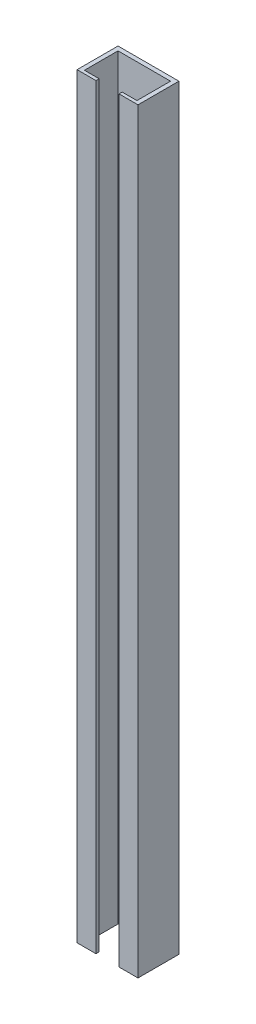
from build123d import *

# Parameters (mm, degrees)
BOSS_EXTRUDE1_DEPTH = 2286


with BuildPart() as part:
    # Sketch1 → Boss-Extrude1 (new, symmetric)
    with BuildSketch(Plane(origin=(0, 0, 0), x_dir=(1, 0, 0), z_dir=(0, 1, 0))):
        Polygon((-184.15, 228.6), (184.15, 228.6), (184.15, -19.05), (69.85, -19.05), (69.85, 0), (158.75, 0), (158.75, 203.2), (-158.75, 203.2), (-158.75, 0), (-69.85, 0), (-69.85, -19.05), (-184.15, -19.05), align=None)
    extrude(amount=BOSS_EXTRUDE1_DEPTH, both=True)


solid = part.part
